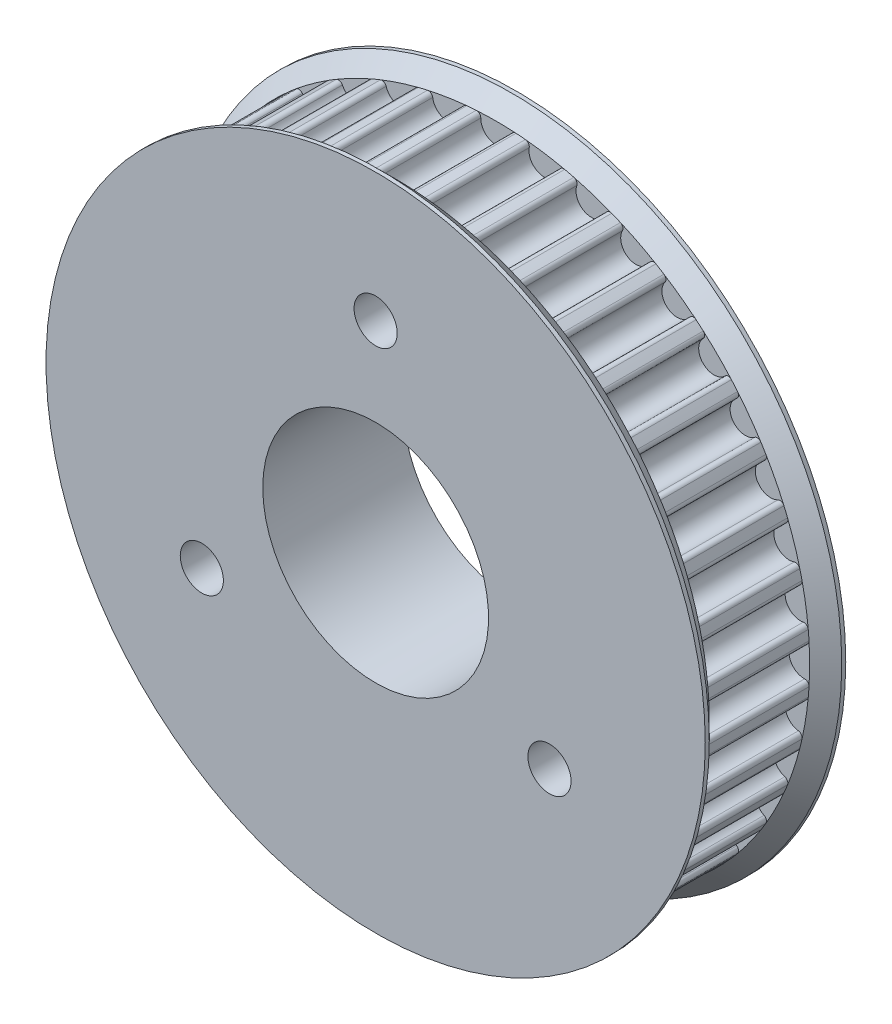
from build123d import *

# Parameters (mm, degrees)
SKETCH1_R           = 31.240988618
BOSS_EXTRUDE1_DEPTH = 10
CUT_EXTRUDE1_DEPTH  = 46.298992701
CIRPATTERN3_COUNT   = 40
SKETCH7_R           = 2.15
SKETCH7_R_2         = 11.25
CUT_EXTRUDE4_DEPTH  = 49.508360793
CHAMFER1_SIZE       = 2.6


with BuildPart() as part:
    # Sketch1 → Boss-Extrude1 (new body)
    with BuildSketch(Plane.XY):
        Circle(SKETCH1_R)
    extrude(amount=BOSS_EXTRUDE1_DEPTH)

    # Sketch1<5> → Cut-Extrude1 (cut, through all)
    with BuildSketch(Plane.XY):
        with BuildLine():
            ThreePointArc((3.459622199, 31.048838692), (3.189890184, 31.077708578), (2.919917655, 31.104235254))
            ThreePointArc((2.919917655, 31.104235254), (3.222284873, 30.936030532), (3.302853885, 30.599537743))
            ThreePointArc((3.302853885, 30.599537743), (6.243344871, 29.825553198), (3.459622199, 31.048838692))
        make_face()
        with BuildLine():
            ThreePointArc((1.440079962, 31.207780113), (-1.500734475, 30.435025454), (1.524632044, 30.739486851))
            ThreePointArc((1.524632044, 30.739486851), (1.656848191, 31.059233074), (1.981805774, 31.17806626))
            ThreePointArc((1.981805774, 31.17806626), (1.711007372, 31.19409918), (1.440079962, 31.207780113))
        make_face()
    cut_extrude1 = extrude(amount=CUT_EXTRUDE1_DEPTH, mode=Mode.SUBTRACT)

    # CirPattern3: Cut-Extrude1 ×40 about axis
    cirpattern3_axis = Axis((0, 0, 10), (0, 0, 1))
    for i in range(1, CIRPATTERN3_COUNT):
        add(cut_extrude1.rotate(cirpattern3_axis, i * 360 / CIRPATTERN3_COUNT), mode=Mode.SUBTRACT)

    # Sketch5 → Revolve1 (revolve)
    with BuildSketch(Plane(origin=(0, 0, 0), x_dir=(0, 0, -1), z_dir=(1, 0, 0))):
        Polygon((0, 31.240988618), (0, 0), (2, 0), (2, 32.840988618), (1.6, 32.840988618), align=None)
    revolve1 = revolve(axis=Axis((0, 0, -1.6), (0, 0, -1)))

    # Mirror1: Revolve1 across plane
    add(revolve1.mirror(Plane.XY.offset(5)))

    # Sketch7 → Cut-Extrude4 (cut, through all)
    with BuildSketch(Plane(origin=(0, 0, -2), x_dir=(-1, 0, 0), z_dir=(0, 0, -1))):
        with Locations((0, 20)):
            Circle(SKETCH7_R)
        Circle(SKETCH7_R_2)
        with Locations((17.320508076, -10)):
            Circle(SKETCH7_R)
        with Locations((-17.320508076, -10)):
            Circle(SKETCH7_R)
    extrude(amount=-CUT_EXTRUDE4_DEPTH, mode=Mode.SUBTRACT)

    # Chamfer1
    chamfer1_edges = [part.edges().sort_by_distance(p)[0] for p in [
        (2.15, 20, -2),
        (-15.170508076, -10, -2),
        (19.470508076, -10, -2),
    ]]
    chamfer(chamfer1_edges, length=CHAMFER1_SIZE)


solid = part.part
